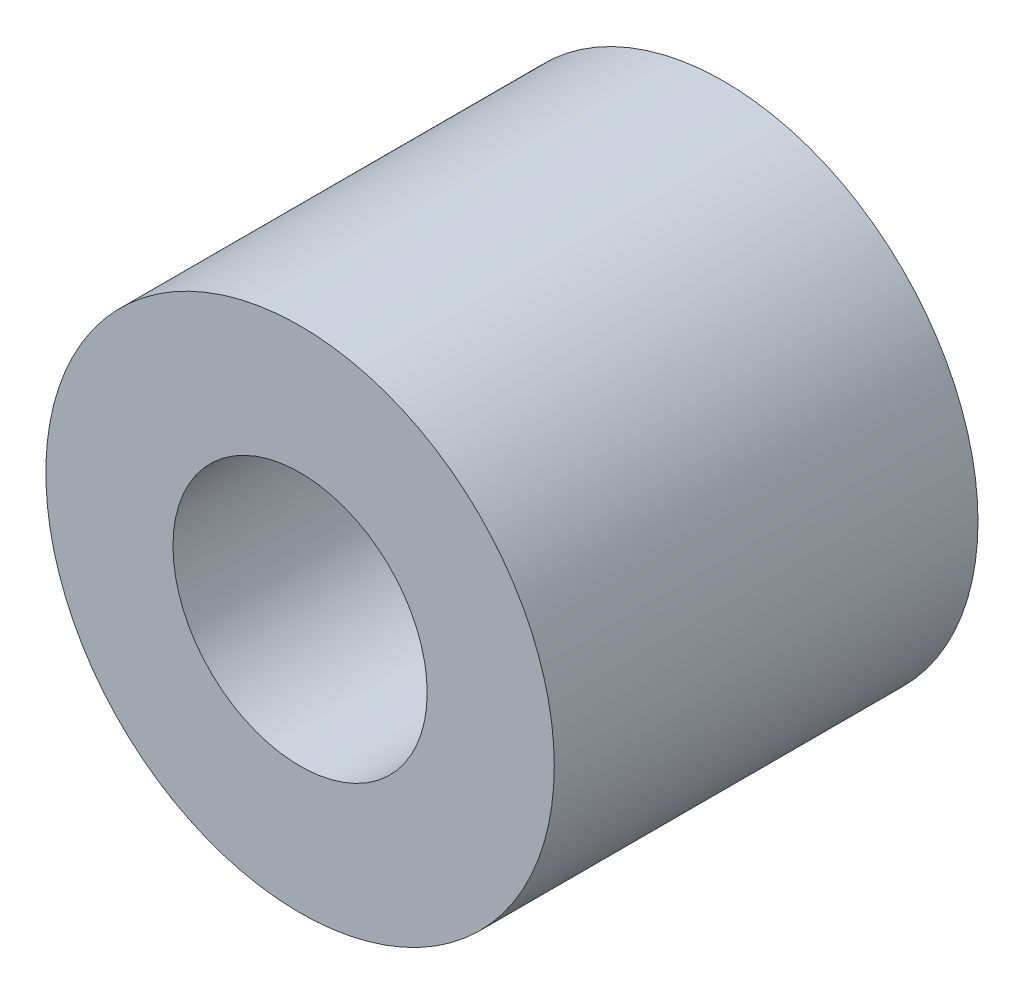
from build123d import *

# Parameters (mm, degrees)
ESQUISSE1_R        = 3
ESQUISSE1_R_2      = 1.5
BOSS_EXTRU_1_DEPTH = 5


with BuildPart() as part:
    # Esquisse1 → Boss.-Extru.1 (new body)
    with BuildSketch(Plane.XY):
        Circle(ESQUISSE1_R)
        Circle(ESQUISSE1_R_2, mode=Mode.SUBTRACT)
    extrude(amount=BOSS_EXTRU_1_DEPTH)


solid = part.part
